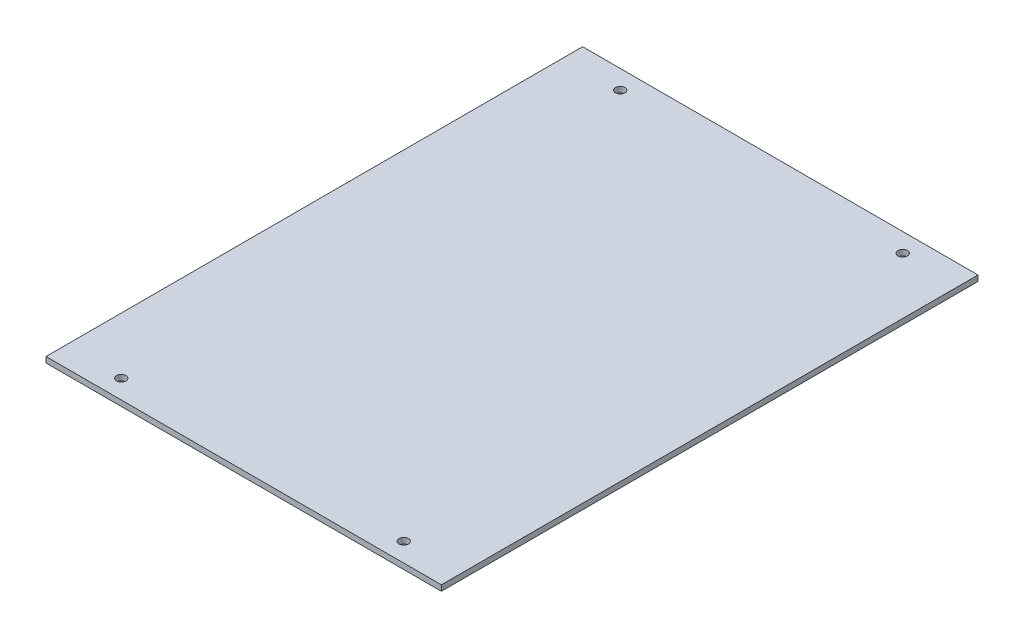
from build123d import *

# Parameters (mm, degrees)
SKETCH1_W           = 210
SKETCH1_H           = 285
SKETCH1_R           = 2.5
BOSS_EXTRUDE1_DEPTH = 3


with BuildPart() as part:
    # Sketch1 → Boss-Extrude1 (new body)
    with BuildSketch(Plane(origin=(0, 0, 0), x_dir=(1, 0, 0), z_dir=(0, 1, 0))):
        Rectangle(SKETCH1_W, SKETCH1_H)
        with Locations(Location((-75, 132.5, 0), (0, 0, 270))):
            Circle(SKETCH1_R, mode=Mode.SUBTRACT)
        with Locations(Location((-75, -132.5, 0), (0, 0, 90))):
            Circle(SKETCH1_R, mode=Mode.SUBTRACT)
        with Locations(Location((75, -132.5, 0), (0, 0, 270))):
            Circle(SKETCH1_R, mode=Mode.SUBTRACT)
        with Locations(Location((75, 132.5, 0), (0, 0, 90))):
            Circle(SKETCH1_R, mode=Mode.SUBTRACT)
    extrude(amount=BOSS_EXTRUDE1_DEPTH)


solid = part.part
